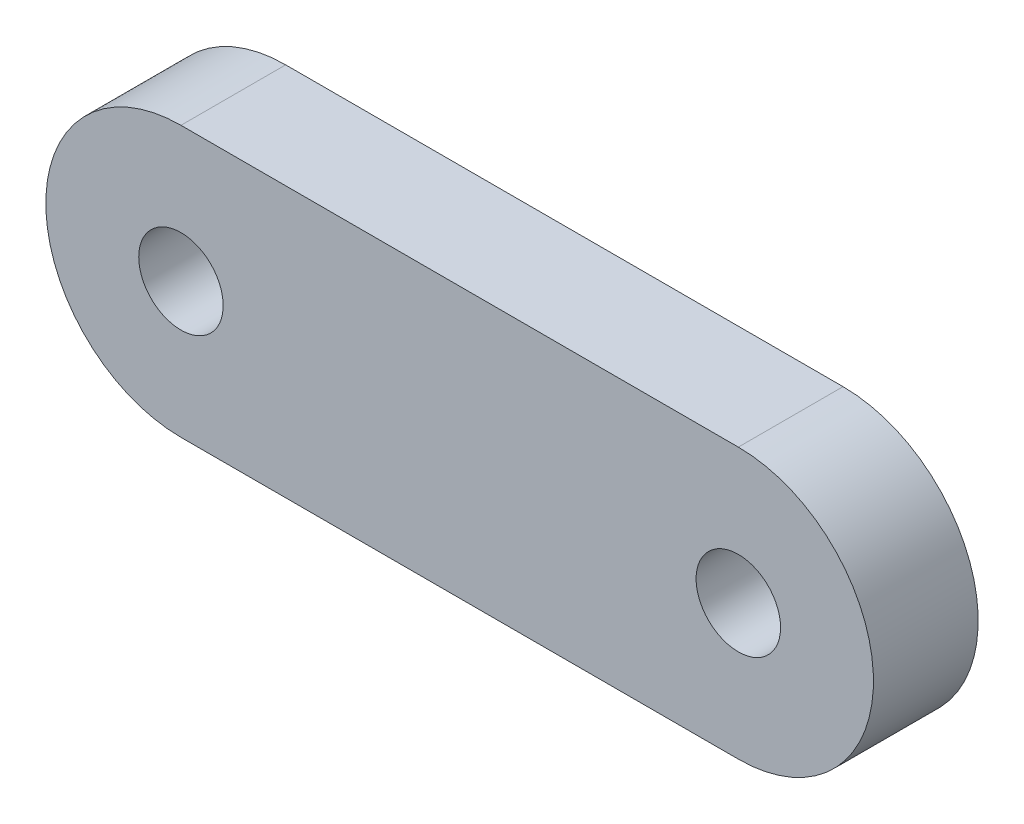
from build123d import *

# Parameters (mm, degrees)
SKETCH1_R           = 2.5
BOSS_EXTRUDE1_DEPTH = 6.2
SKETCH2_R           = 2.5
CUT_EXTRUDE1_DEPTH  = 16.2


with BuildPart() as part:
    # Sketch1 → Boss-Extrude1 (new body)
    with BuildSketch(Plane.XY):
        with BuildLine():
            Line((0, 8), (33, 8))
            ThreePointArc((33, 8), (41, 0), (33, -8))
            Line((33, -8), (0, -8))
            ThreePointArc((0, -8), (-8, 0), (0, 8))
        make_face()
        with Locations(Location((0, 0, 0), (0, 0, 180))):
            Circle(SKETCH1_R, mode=Mode.SUBTRACT)
    extrude(amount=BOSS_EXTRUDE1_DEPTH)

    # Sketch2 → Cut-Extrude1 (cut)
    with BuildSketch(Plane.XY.offset(6.2)):
        with Locations((33, 0)):
            Circle(SKETCH2_R)
    extrude(amount=-CUT_EXTRUDE1_DEPTH, mode=Mode.SUBTRACT)


solid = part.part
